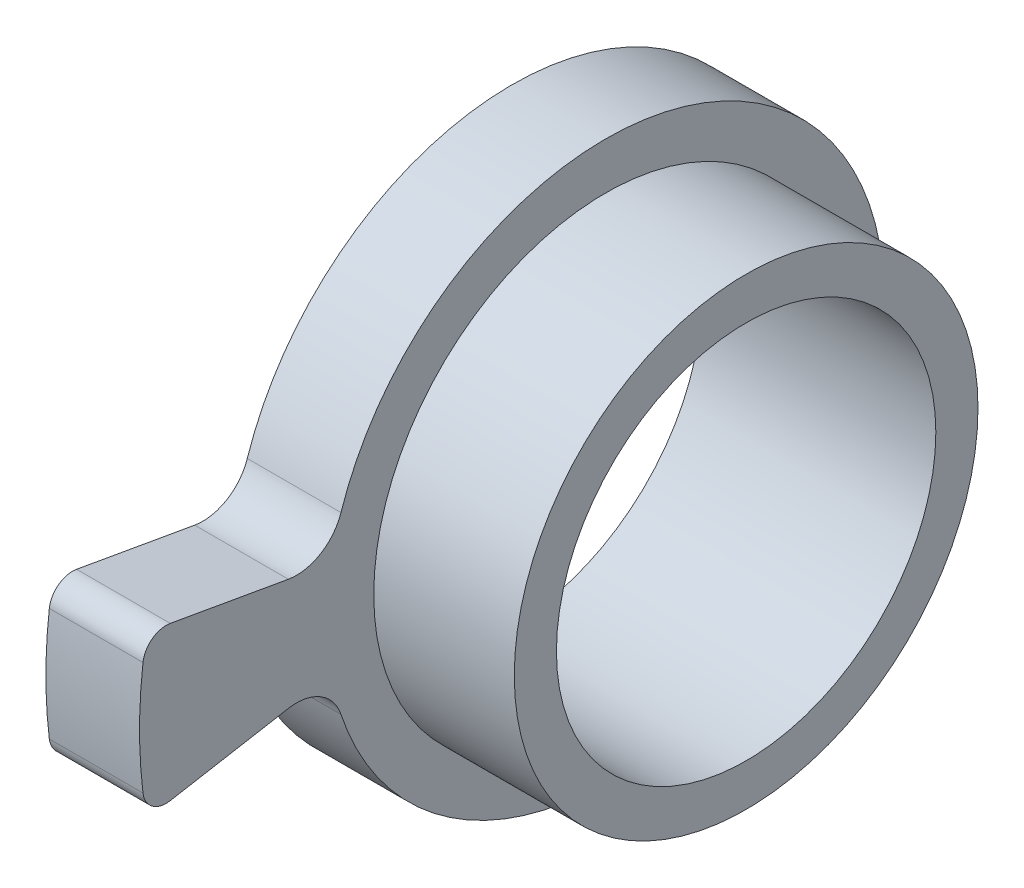
from build123d import *

# Parameters (mm, degrees)
BOSS_EXTRU_1_START = -2
BOSS_EXTRU_1_DEPTH = 2
CONG_1_R           = 1
CONG_3_R           = 0.5


with BuildPart() as part:
    # Esquisse1 → Révolution1 (revolve)
    with BuildSketch(Plane.XY, mode=Mode.PRIVATE) as r_volution1_sk:
        Polygon((0, 4.05), (0, 5.95), (2, 5.95), (2, 4.95), (5, 4.95), (5, 4.05), align=None)
    revolve(r_volution1_sk.sketch.rotate(Axis((-3.996004355, 0, 0), (1, 0, 0)), 90), axis=Axis((-3.996004355, 0, 0), (1, 0, 0)))

    # Esquisse2 → Boss.-Extru.1 (add)
    with BuildSketch(Plane.ZY.offset(BOSS_EXTRU_1_START)):
        with BuildLine():
            Line((5.85960613, -1.033206657), (9.798837142, -1.727799368))
            ThreePointArc((9.798837142, -1.727799368), (9.95, 0), (9.798837142, 1.727799368))
            Line((9.798837142, 1.727799368), (5.85960613, 1.033206657))
            ThreePointArc((5.85960613, 1.033206657), (5.95, 0), (5.85960613, -1.033206657))
        make_face()
    extrude(amount=BOSS_EXTRU_1_DEPTH)

    # Congé1
    cong_1_edges = [part.edges().sort_by_distance(p)[0] for p in [
        (1, -1.033206657, 5.85960613),
        (1, 1.033206657, 5.85960613),
    ]]
    fillet(cong_1_edges, radius=CONG_1_R)

    # Congé3
    cong_3_edges = [part.edges().sort_by_distance(p)[0] for p in [
        (1, 1.727799368, 9.798837142),
        (1, -1.727799368, 9.798837142),
    ]]
    fillet(cong_3_edges, radius=CONG_3_R)


solid = part.part
